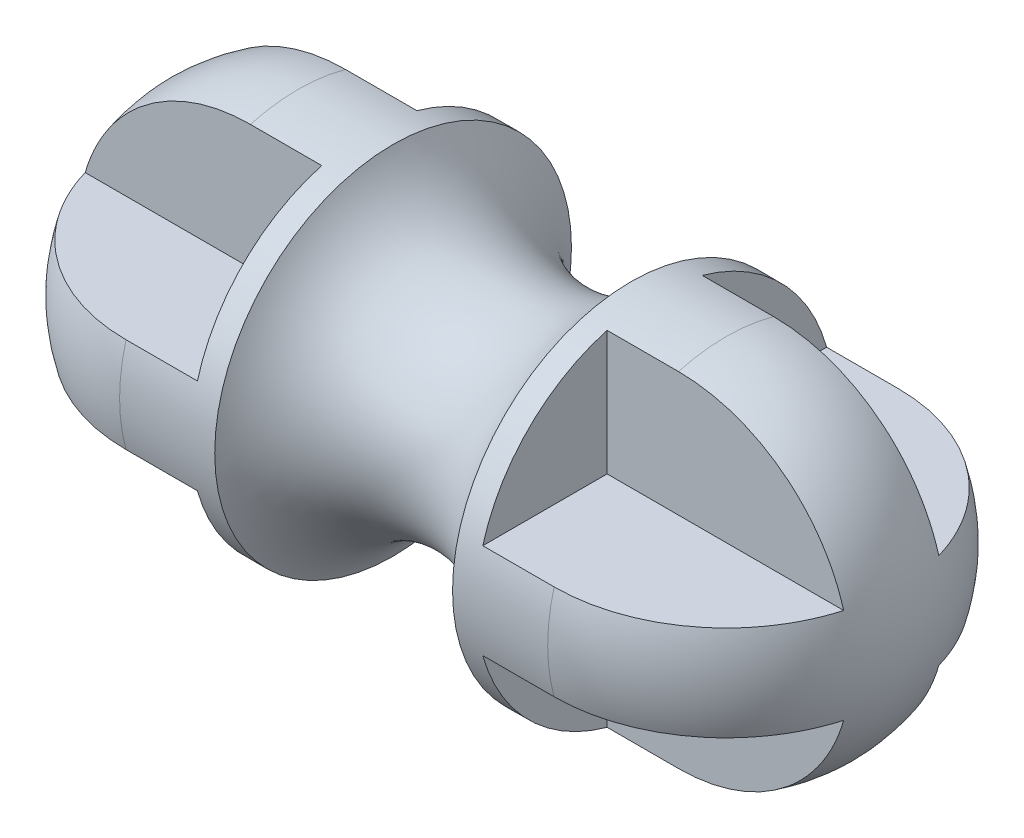
from build123d import *

# Parameters (mm, degrees)
CUT_EXTRUDE_1_DEPTH = 125.373429638


with BuildPart() as part:
    # 草图1 → 旋转1 (revolve)
    with BuildSketch(Plane.XY, mode=Mode.PRIVATE) as revolve_1_sk:
        with BuildLine():
            Line((45, 37.5), (25, 37.5))
            ThreePointArc((25, 37.5), (0, 22.5), (-25, 37.5))
            Line((-25, 37.5), (-45, 37.5))
            ThreePointArc((-45, 37.5), (-71.516504294, 26.516504294), (-82.5, 0))
            Line((-82.5, 0), (82.5, 0))
            ThreePointArc((82.5, 0), (71.516504294, 26.516504294), (45, 37.5))
        make_face()
    revolve(revolve_1_sk.sketch.rotate(Axis((-82.5, 0, 0), (1, 0, 0)), 180), axis=Axis((-82.5, 0, 0), (1, 0, 0)))

    # 草图2 → 切除-拉伸1 (cut, through all)
    with BuildSketch(Plane(origin=(30, 0, 0), x_dir=(0, 0, -1), z_dir=(1, 0, 0))):
        with BuildLine():
            Line((10, 36.142080737), (10, 10))
            Line((10, 10), (36.142080737, 10))
            ThreePointArc((36.142080737, 10), (26.516504294, 26.516504294), (10, 36.142080737))
        make_face()
        with BuildLine():
            Line((-10, 10), (-36.142080737, 10))
            ThreePointArc((-36.142080737, 10), (-26.516504294, 26.516504294), (-10, 36.142080737))
            Line((-10, 36.142080737), (-10, 10))
        make_face()
        with BuildLine():
            Line((-10, -10), (-36.142080737, -10))
            ThreePointArc((-36.142080737, -10), (-26.516504294, -26.516504294), (-10, -36.142080737))
            Line((-10, -36.142080737), (-10, -10))
        make_face()
        with BuildLine():
            Line((10, -10), (36.142080737, -10))
            ThreePointArc((36.142080737, -10), (26.516504294, -26.516504294), (10, -36.142080737))
            Line((10, -36.142080737), (10, -10))
        make_face()
    cut_extrude_1 = extrude(amount=CUT_EXTRUDE_1_DEPTH, mode=Mode.SUBTRACT)

    # 镜向1: 切除-拉伸1 across plane
    add(cut_extrude_1.mirror(Plane(origin=(0, 0, 0), x_dir=(0, 0, 1), z_dir=(1, 0, 0))), mode=Mode.SUBTRACT)


solid = part.part
